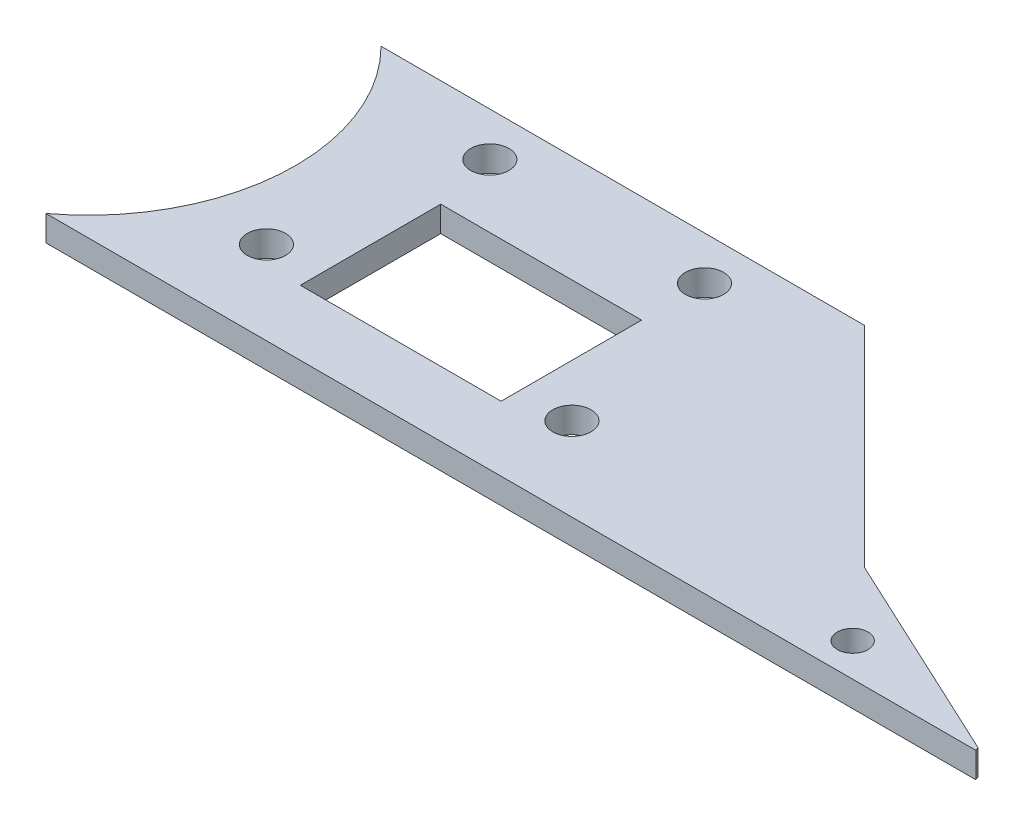
from build123d import *

# Parameters (mm, degrees)
SKETCH_1_R               = 1.5
SKETCH_1_W               = 15.730611704
SKETCH_1_H               = 11
EXTRUDE_1_DEPTH          = 2
CUT_EXTRUDE_1_DEPTH      = 106.5
CUT_EXTRUDE_1_DEPTH_BACK = 62.743635726
SKETCH_7_R               = 1.2
CUT_EXTRUDE_5_DEPTH      = 15


with BuildPart() as part:
    # Эскиз1 → Бобышка-Вытянуть1 (new body)
    with BuildSketch(Plane(origin=(0, 0, 0), x_dir=(1, 0, 0), z_dir=(0, 1, 0))):
        with BuildLine():
            Line((-56.923759365, -23.831956958), (16.382902061, -23.831956958))
            Line((16.382902061, -23.831956958), (-0.836945892, -15.802209985))
            Line((-0.836945892, -15.802209985), (-17.271974735, 0.632818857))
            Line((-17.271974735, 0.632818857), (-55.146365247, 0.632818857))
            ThreePointArc((-55.146365247, 0.632818857), (-50.679018006, -7.808361393), (-51.74094673, -17.29956905))
            ThreePointArc((-51.74094673, -17.29956905), (-53.905020217, -20.904809923), (-56.923759365, -23.831956958))
        make_face()
        with Locations((-43.205666325, -2.789799404)):
            Circle(SKETCH_1_R, mode=Mode.SUBTRACT)
        with Locations((-26.393046621, -2.789799404)):
            Circle(SKETCH_1_R, mode=Mode.SUBTRACT)
        with Locations((-46.193307824, -17.29956905)):
            Circle(SKETCH_1_R, mode=Mode.SUBTRACT)
        with Locations((-22.266173528, -17.29956905)):
            Circle(SKETCH_1_R, mode=Mode.SUBTRACT)
        with Locations((-34.23147938, -13.242579452)):
            Rectangle(SKETCH_1_W, SKETCH_1_H, mode=Mode.SUBTRACT)
    extrude(amount=EXTRUDE_1_DEPTH)

    # Эскиз2 → Вырез-Вытянуть1 (cut, two sides: drawn at the far end of the back side and taken through both)
    with BuildSketch(Plane(origin=(0, 2, 0), x_dir=(1, 0, 0), z_dir=(0, 1, 0)).offset(-CUT_EXTRUDE_1_DEPTH_BACK)):
        Polygon((16.382902061, -23.831956958), (15.800338645, -23.560303176), (15.899212536, -23.831956958), align=None)
    extrude(amount=CUT_EXTRUDE_1_DEPTH + CUT_EXTRUDE_1_DEPTH_BACK, mode=Mode.SUBTRACT)

    # Эскиз7 → Вырез-Вытянуть5 (cut)
    with BuildSketch(Plane.XZ):
        with Locations((3.651057562, 21.224691708)):
            Circle(SKETCH_7_R)
    extrude(amount=-CUT_EXTRUDE_5_DEPTH, mode=Mode.SUBTRACT)


solid = part.part
